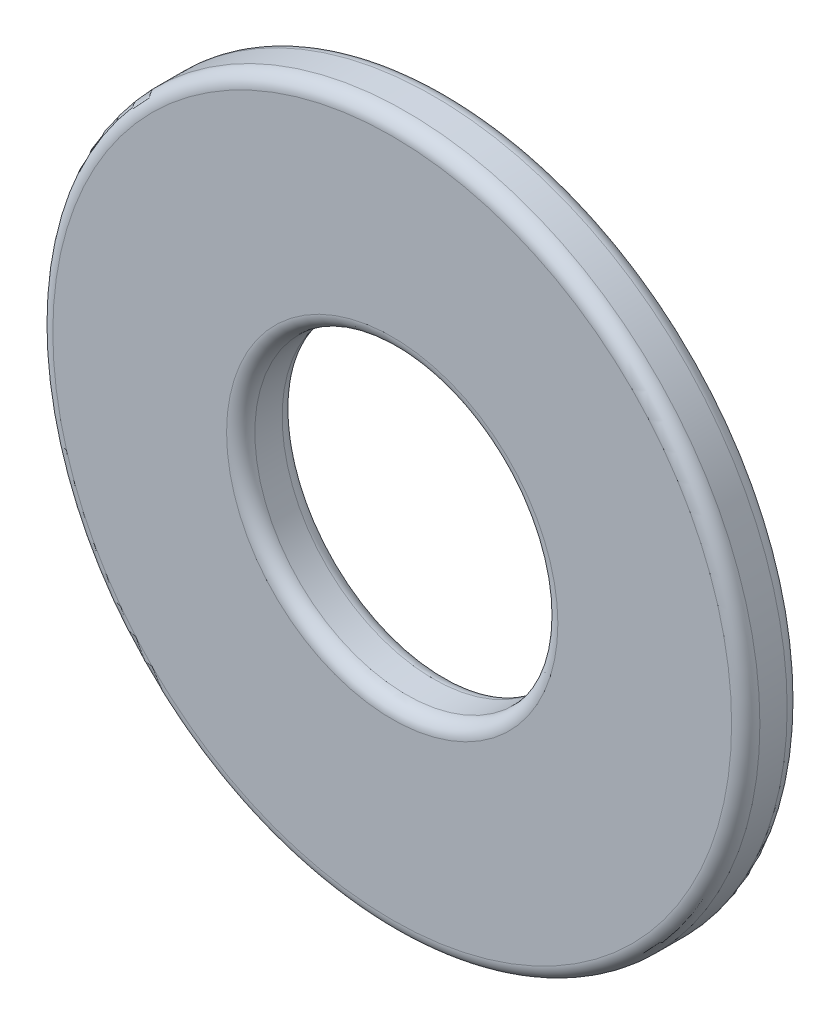
from build123d import *

# Parameters (mm, degrees)
BOSS_EXTRUDE1_DEPTH      = 0.275
BOSS_EXTRUDE1_DEPTH_BACK = 0.275
SKETCH3_R                = 3.5
SKETCH3_R_2              = 1.5
FILLET1_R                = 0.14


with BuildPart() as part:
    # Sketch3 → Boss-Extrude1 (new, two sides: drawn at the far end of the back side and taken through both)
    with BuildSketch(Plane.XY.offset(-BOSS_EXTRUDE1_DEPTH_BACK)):
        Circle(SKETCH3_R)
        Circle(SKETCH3_R_2, mode=Mode.SUBTRACT)
    extrude(amount=BOSS_EXTRUDE1_DEPTH + BOSS_EXTRUDE1_DEPTH_BACK)

    # Fillet1
    fillet1_edges = [part.edges().sort_by_distance(p)[0] for p in [
        (-3.5, 0, -0.275),
        (-1.5, 0, -0.275),
        (-3.5, 0, 0.275),
        (-1.5, 0, 0.275),
    ]]
    fillet(fillet1_edges, radius=FILLET1_R)


solid = part.part
